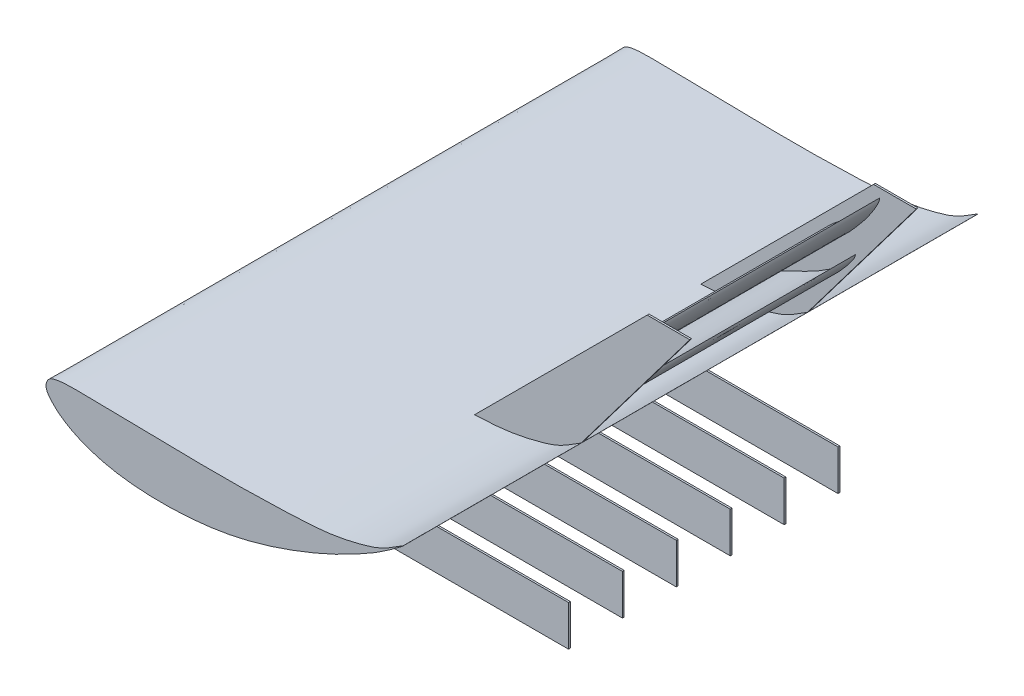
from build123d import *

# Parameters (mm, degrees)
BOSS_EXTRUDE1_DEPTH      = 450
BOSS_EXTRUDE1_DEPTH_BACK = 190
BOSS_EXTRUDE2_DEPTH      = 250
BOSS_EXTRUDE3_DEPTH      = 250
BOSS_EXTRUDE4_DEPTH      = 2
BOSS_EXTRUDE5_DEPTH      = 2
LPATTERN1_COUNT          = 6
LPATTERN1_PITCH          = 60


with BuildPart() as part:
    # Sketch2 → Boss-Extrude1 (new, two sides: drawn at the far end of the back side and taken through both)
    with BuildSketch(Plane.XY.offset(-BOSS_EXTRUDE1_DEPTH_BACK)):
        with BuildLine():
            add(Edge.make_bspline(
                [(331.632547469, -0.155801536), (331.304804648, -0.038615704), (310.948001787, -13.886411779), (288.850742925, -21.453130062), (253.898831549, -29.814375257), (214.402036751, -32.174399069), (174.203238421, -33.535466036), (134.096691432, -34.220910528), (93.868451095, -33.829088664), (53.62355674, -32.933544742), (20.067576666, -32.58062124), (-6.777768577, -32.081964586), (-26.866972083, -31.763971163), (-43.660957345, -31.602077129), (-55.316512, -33.133657225), (-63.217346314, -35.786601004), (-68.168954816, -45.852182452), (-60.935621688, -55.143256382), (-52.810223066, -63.238049464), (-43.602034193, -69.792541019), (-32.757735565, -75.632989434), (-18.848696071, -81.50408464), (-1.571951466, -86.671839376), (25.726118264, -91.610196978), (59.59912915, -93.637086079), (99.829747098, -91.985368399), (139.702918156, -86.499514592), (178.98654912, -76.560782021), (217.989675389, -62.830670059), (256.048180454, -46.795741281), (289.832491564, -28.762312202), (310.639103485, -16.232870327), (331.977351639, -0.279087725), (331.632547469, -0.155801536)],
                knots=[0, 0, 0, 0, 0.026267805, 0.05101645, 0.098803999, 0.146245906, 0.193788091, 0.241403109, 0.289125069, 0.336906896, 0.384666303, 0.408554379, 0.43243685, 0.456234374, 0.468111913, 0.474323291, 0.485191068, 0.501620174, 0.510955397, 0.526909994, 0.541277728, 0.554823463, 0.580548385, 0.605270102, 0.653410558, 0.700937477, 0.748405772, 0.79632416, 0.845052217, 0.894743241, 0.94586851, 0.972364768, 1, 1, 1, 1], degree=3))
        make_face()
    extrude(amount=BOSS_EXTRUDE1_DEPTH + BOSS_EXTRUDE1_DEPTH_BACK)



with BuildPart() as body_2:
    # Sketch2<3> → Boss-Extrude2 (new body)
    with BuildSketch(Plane.XY):
        with BuildLine():
            add(Edge.make_bspline(
                [(385.257108205, 82.500998533), (385.262718652, 82.657045888), (384.403940943, 80.687432876), (383.657706576, 79.56840288), (382.553376289, 77.880744826), (381.233954331, 76.184864639), (379.61594752, 74.258915124), (377.736638316, 72.185446603), (375.60037444, 70.008528092), (373.309357382, 67.729611065), (370.848412879, 65.463576841), (368.293558252, 63.204775791), (365.670442902, 60.975213159), (362.960640755, 58.823348985), (360.203555415, 56.707277406), (357.380855488, 54.655553979), (354.491780752, 52.664392505), (351.549990289, 50.712937144), (348.535317242, 48.824783821), (345.459140164, 46.97521262), (342.311610123, 45.164747337), (339.089536673, 43.392367707), (335.790722934, 41.638176888), (332.415279089, 39.903970969), (328.964217848, 38.171435976), (325.436978114, 36.454789012), (321.858304333, 34.715167763), (318.229022674, 32.983721032), (314.604470592, 31.240931416), (311.029640761, 29.517736405), (307.560681425, 27.861865366), (304.282963455, 26.214837697), (301.21634104, 24.634441536), (298.438022747, 23.094390469), (295.987599383, 21.705919431), (293.95353301, 20.479373817), (292.319432576, 19.464657151), (291.025508113, 18.656269033), (290.006404313, 17.976500048), (289.197724902, 17.387794544), (288.519811704, 16.890485717), (287.960517662, 16.43974363), (287.491120754, 16.025982717), (287.102483552, 15.628801651), (286.801311256, 15.221074048), (286.620429119, 14.776157027), (286.630563726, 14.313890741), (286.79585874, 13.900921156), (287.049630073, 13.538720769), (287.33911776, 13.180813577), (287.701362098, 12.840834513), (288.12857904, 12.511641561), (288.613828785, 12.17448135), (289.174108848, 11.837901495), (289.831514382, 11.525459152), (290.574572898, 11.185189517), (291.448138906, 10.886107434), (292.456337958, 10.57903469), (293.639228133, 10.330006302), (295.008806857, 10.106803979), (296.581131911, 9.935256527), (298.356625654, 9.840500169), (300.302687346, 9.838403517), (302.383471629, 9.965075455), (304.550884742, 10.23286767), (306.770919976, 10.662341838), (309.014855996, 11.254763585), (311.277583013, 12.004951978), (313.554633497, 12.923876771), (315.843408831, 14.040342457), (318.179815559, 15.317754704), (320.56157534, 16.827336468), (323.046696009, 18.540389618), (325.646982127, 20.497688236), (328.400201588, 22.653022964), (331.288852626, 24.971043441), (334.271310095, 27.418603889), (337.317258268, 29.936530581), (340.392398086, 32.478079948), (343.429471804, 35.041894513), (346.434689872, 37.565239214), (349.369794303, 40.070591518), (352.210756975, 42.580941419), (354.983071887, 45.080285535), (357.691572396, 47.589560364), (360.325362768, 50.144615375), (362.915500017, 52.741685683), (365.469865367, 55.378268458), (367.979827785, 58.066762505), (370.450880224, 60.774207375), (372.8462526, 63.48980126), (375.132812849, 66.162720111), (377.240585914, 68.748948508), (379.141540172, 71.160075747), (380.769551114, 73.369334894), (382.123157635, 75.328211383), (383.196109299, 77.0816532), (384.035946379, 78.61947015), (384.607394543, 80.176109737), (384.884574537, 81.247822033), (385.253896678, 82.411674068), (385.257108205, 82.500998533)],
                knots=[0, 0, 0, 0, 0.00687178, 0.013318497, 0.020777589, 0.02943689, 0.039410878, 0.050612524, 0.062849331, 0.075765159, 0.089149388, 0.102734838, 0.116433622, 0.130198357, 0.143995866, 0.157878947, 0.171808007, 0.185837334, 0.19997499, 0.214225182, 0.228640874, 0.243274633, 0.258077981, 0.273195932, 0.288529679, 0.304128025, 0.319976941, 0.335982504, 0.352082187, 0.367938781, 0.383309211, 0.397921185, 0.411683605, 0.424447294, 0.435801067, 0.445269473, 0.452770848, 0.458740355, 0.463463732, 0.467375516, 0.470668278, 0.473489106, 0.475938642, 0.478127703, 0.480104281, 0.481956658, 0.483742746, 0.485466599, 0.487184503, 0.489002786, 0.490948619, 0.493091457, 0.495430759, 0.497992892, 0.500874767, 0.504106146, 0.507732688, 0.511874729, 0.516668635, 0.522133279, 0.528420065, 0.535519847, 0.543327695, 0.551615211, 0.560364178, 0.569353407, 0.578559851, 0.588022127, 0.597764961, 0.607818479, 0.618374991, 0.629504087, 0.641429754, 0.654362395, 0.668309494, 0.683127591, 0.698529964, 0.714320123, 0.730256731, 0.746106292, 0.761718272, 0.777054096, 0.792125015, 0.806928363, 0.821567252, 0.836153821, 0.850685769, 0.865307939, 0.87993042, 0.894546754, 0.909020415, 0.923112208, 0.936492017, 0.948805381, 0.959726546, 0.969206481, 0.977217575, 0.98415149, 0.990330215, 0.996066463, 1, 1, 1, 1], degree=3))
        make_face()
    extrude(amount=BOSS_EXTRUDE2_DEPTH)


with BuildPart() as body_3:
    # Sketch2<4> → Boss-Extrude3 (new body)
    with BuildSketch(Plane.XY):
        with BuildLine():
            add(Edge.make_bspline(
                [(412.154609526, 150.484462569), (412.140228109, 150.587563161), (411.804420618, 149.195019595), (411.444034038, 148.37394516), (410.914371183, 147.138089374), (410.244444203, 145.871935257), (409.405118851, 144.420165959), (408.411316021, 142.841294963), (407.26078849, 141.164758592), (406.020467443, 139.403341197), (404.667091101, 137.630710129), (403.251221795, 135.851956371), (401.787151898, 134.084496527), (400.257173984, 132.358013376), (398.692009287, 130.649555681), (397.076316795, 128.975749124), (395.410035703, 127.33401991), (393.704548111, 125.712256629), (391.943882107, 124.123616288), (390.138369862, 122.553186552), (388.281484535, 121.000171151), (386.371249588, 119.463530895), (384.40852605, 117.929948419), (382.393178336, 116.400615682), (380.327991454, 114.863626089), (378.210951174, 113.328248762), (376.062802091, 111.771833645), (373.880480661, 110.214926771), (371.702577493, 108.651120378), (369.55505052, 107.105934717), (367.469237813, 105.61720598), (365.507958669, 104.156422401), (363.677558258, 102.763822543), (362.031770035, 101.43108645), (360.583709728, 100.235827387), (359.390258446, 99.195078354), (358.434877728, 98.339705419), (357.678949914, 97.659175745), (357.088562796, 97.094904222), (356.625785385, 96.614779255), (356.238280452, 96.209797935), (355.92326274, 95.849121473), (355.662984816, 95.523131558), (355.453809375, 95.217376135), (355.303278937, 94.914821918), (355.23602887, 94.601776861), (355.296197095, 94.299454484), (355.452527247, 94.047459503), (355.661068189, 93.839038956), (355.892561289, 93.637571778), (356.169746474, 93.456297812), (356.488340016, 93.289626927), (356.845956661, 93.124443423), (357.252766413, 92.968326863), (357.720548487, 92.839301284), (358.24778648, 92.701921672), (358.855939571, 92.606691533), (359.553409481, 92.521801073), (360.358851308, 92.495242163), (361.283871589, 92.507251144), (362.336022794, 92.576644557), (363.512672308, 92.719974196), (364.790579456, 92.943884373), (366.142030218, 93.267932311), (367.53401929, 93.694659769), (368.941839626, 94.233629477), (370.346488048, 94.882347431), (371.745209556, 95.63682061), (373.133801126, 96.503733895), (374.507222101, 97.501697714), (375.893282868, 98.610843218), (377.282242452, 99.877667265), (378.715507482, 101.290043731), (380.196107875, 102.876108931), (381.754189157, 104.609896859), (383.382353095, 106.466172544), (385.057108313, 108.418355749), (386.765401642, 110.424087135), (388.490125721, 112.448707099), (390.187280399, 114.483538284), (391.868205628, 116.488111662), (393.505181453, 118.472755601), (395.07977104, 120.449782292), (396.610564819, 122.411636222), (398.098312352, 124.372622544), (399.531710039, 126.355016465), (400.931583852, 128.359941524), (402.303397855, 130.386666888), (403.640050093, 132.442333676), (404.948962582, 134.505937977), (406.20724482, 136.566131284), (407.399028003, 138.585710102), (408.483466274, 140.527675921), (409.452390702, 142.330738615), (410.265486683, 143.969669729), (410.927411259, 145.412448434), (411.428857353, 146.687861232), (411.802216658, 147.794721388), (411.997189294, 148.882869166), (412.055101374, 149.618577418), (412.162841723, 150.425445835), (412.154609526, 150.484462569)],
                knots=[0, 0, 0, 0, 0.00687178, 0.013318497, 0.020777589, 0.02943689, 0.039410878, 0.050612524, 0.062849331, 0.075765159, 0.089149388, 0.102734838, 0.116433622, 0.130198357, 0.143995866, 0.157878947, 0.171808007, 0.185837334, 0.19997499, 0.214225182, 0.228640874, 0.243274633, 0.258077981, 0.273195932, 0.288529679, 0.304128025, 0.319976941, 0.335982504, 0.352082187, 0.367938781, 0.383309211, 0.397921185, 0.411683605, 0.424447294, 0.435801067, 0.445269473, 0.452770848, 0.458740355, 0.463463732, 0.467375516, 0.470668278, 0.473489106, 0.475938642, 0.478127703, 0.480104281, 0.481956658, 0.483742746, 0.485466599, 0.487184503, 0.489002786, 0.490948619, 0.493091457, 0.495430759, 0.497992892, 0.500874767, 0.504106146, 0.507732688, 0.511874729, 0.516668635, 0.522133279, 0.528420065, 0.535519847, 0.543327695, 0.551615211, 0.560364178, 0.569353407, 0.578559851, 0.588022127, 0.597764961, 0.607818479, 0.618374991, 0.629504087, 0.641429754, 0.654362395, 0.668309494, 0.683127591, 0.698529964, 0.714320123, 0.730256731, 0.746106292, 0.761718272, 0.777054096, 0.792125015, 0.806928363, 0.821567252, 0.836153821, 0.850685769, 0.865307939, 0.87993042, 0.894546754, 0.909020415, 0.923112208, 0.936492017, 0.948805381, 0.959726546, 0.969206481, 0.977217575, 0.98415149, 0.990330215, 0.996066463, 1, 1, 1, 1], degree=3))
        make_face()
    extrude(amount=BOSS_EXTRUDE3_DEPTH)


with BuildPart() as part_1:
    add(part.part)

    add(body_2.part)  # Boss-Extrude4 merges body 2

    add(body_3.part)  # Boss-Extrude4 merges body 3
    # Sketch3 → Boss-Extrude4 (add)
    with BuildSketch(Plane.XY):
        with BuildLine():
            Line((213.125966849, -32.061833101), (405.369105002, 160.181305053))
            Line((405.369105002, 160.181305053), (452.864487175, 160.181305053))
            Line((452.864487175, 160.181305053), (331.632547469, -0.155801536))
            add(Edge.make_bspline(
                [(331.632547469, -0.155801536), (331.304804648, -0.038615704), (310.948001787, -13.886411779), (288.850742925, -21.453130062), (253.898831549, -29.814375257), (227.164983916, -31.411783789), (213.51914951, -32.043772488), (213.125966849, -32.061833101)],
                knots=[0, 0, 0, 0, 0.026267805, 0.05101645, 0.098803999, 0.146245906, 0.147653033, 0.147653033, 0.147653033, 0.147653033], degree=3))
        make_face()
    boss_extrude4 = extrude(amount=-BOSS_EXTRUDE4_DEPTH)

    # Mirror1: Boss-Extrude4 across plane
    add(boss_extrude4.mirror(Plane.XY.offset(125)))

    # Sketch4 → Boss-Extrude5 (add)
    with BuildSketch(Plane.XY.offset(65)):
        with BuildLine():
            Line((78.317658396, -92.701211002), (430.835794689, -92.701211002))
            Line((430.835794689, -92.701211002), (430.835794689, -47.701211002))
            Line((430.835794689, -47.701211002), (252.578779402, -47.701211002))
            add(Edge.make_bspline(
                [(78.317658396, -92.701211002), (85.487296777, -92.436977364), (105.968339263, -91.140805042), (139.702918156, -86.499514592), (178.98654912, -76.560782021), (216.835339314, -63.237026295), (240.830238981, -53.203892018), (252.578779402, -47.701211002)],
                knots=[0.675412528, 0.675412528, 0.675412528, 0.675412528, 0.700937477, 0.748405772, 0.79632416, 0.845052217, 0.890412239, 0.890412239, 0.890412239, 0.890412239], degree=3))
        make_face()
    boss_extrude5 = extrude(amount=-BOSS_EXTRUDE5_DEPTH)

    # LPattern1: Boss-Extrude5 ×6
    with Locations(*[(0, 0, i * LPATTERN1_PITCH) for i in range(1, LPATTERN1_COUNT)]):
        add(boss_extrude5)


solid = part_1.part
